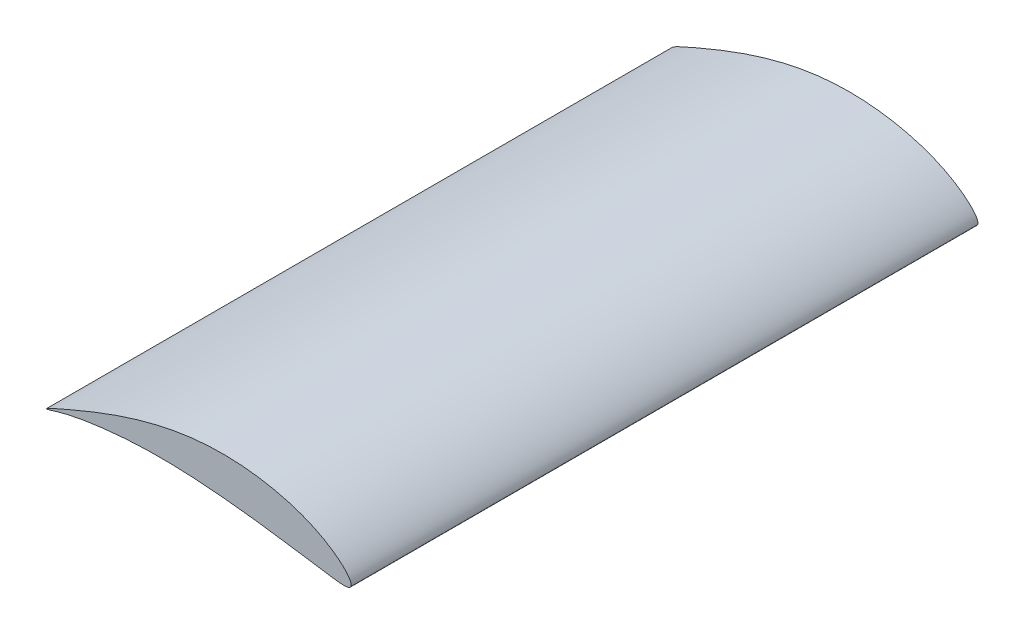
from build123d import *


with BuildPart() as part:
    # Sketch6 → Loft2 section 0
    with BuildSketch(Plane.XY.offset(575)):
        with BuildLine():
            Line((-280, 0.014), (-280, -0.0168))
            add(Edge.make_bspline(
                [(-280, 0.014), (-279.771204707, 0.168298563), (-278.925281642, 0.738785445), (-277.112099036, 1.81145493), (-274.256791715, 3.264911574), (-270.467152625, 4.947271328), (-265.823521768, 7.000905948), (-260.303724905, 9.42028278), (-253.91402689, 12.132526753), (-246.737129962, 15.134341951), (-238.843430318, 18.359152479), (-230.30810541, 21.720163504), (-221.209548369, 25.118644521), (-211.633086788, 28.475876512), (-201.657330859, 31.701051441), (-191.372693181, 34.739781453), (-180.858920985, 37.510498345), (-170.19634542, 39.945230809), (-159.46298851, 41.984143964), (-148.709485723, 43.578045859), (-137.965500671, 44.716042347), (-127.257988986, 45.368899266), (-116.627978631, 45.553296355), (-106.135165373, 45.2525479), (-95.831255312, 44.496915143), (-85.772634554, 43.300166367), (-76.015847778, 41.694402165), (-66.616324533, 39.711164622), (-57.631519759, 37.370622878), (-49.113009814, 34.710585168), (-41.121037488, 31.740670977), (-33.708616725, 28.508626142), (-26.931195064, 25.059138298), (-20.833732482, 21.471381025), (-15.446976943, 17.852019017), (-10.800507764, 14.285567161), (-6.927579355, 10.830684658), (-3.847816492, 7.562749849), (-1.603242544, 4.574322216), (-0.316842727, 2.089931642), (0.095551608, 0.147701002), (-0.190440036, -1.480082181), (-1.61812191, -2.811045927), (-3.984562706, -3.430210094), (-7.073967139, -3.624022711), (-10.943199102, -3.40377583), (-15.571371355, -2.867925005), (-20.94644222, -2.096282411), (-27.038024035, -1.181253274), (-33.809090153, -0.184623427), (-41.207726299, 0.925009114), (-49.187017114, 2.121630313), (-57.689757713, 3.391059344), (-66.663520395, 4.695267901), (-76.051592973, 6.00864435), (-85.798563098, 7.298385015), (-95.847404644, 8.537804845), (-106.140739912, 9.705668586), (-116.623055594, 10.774641585), (-127.242646453, 11.725374761), (-137.939971466, 12.533150396), (-148.676044421, 13.17282768), (-159.423043152, 13.618134398), (-170.153814535, 13.851060052), (-180.816971888, 13.85021665), (-191.33398763, 13.611065767), (-201.623483582, 13.125096615), (-211.601932998, 12.43090999), (-221.184797018, 11.549819182), (-230.291064503, 10.525338005), (-238.836766895, 9.364172827), (-246.740627761, 8.100177645), (-253.922603644, 6.76061863), (-260.310347725, 5.398675468), (-265.845478515, 4.059802982), (-270.478571586, 2.730749917), (-274.209001992, 1.523994274), (-277.055525725, 0.667762124), (-278.895533479, 0.202482489), (-279.77017857, 0.028829102), (-280, -0.0168)],
                knots=[0, 0, 0, 0, 0.001413477, 0.005226038, 0.010781091, 0.017815608, 0.026460951, 0.036790889, 0.048685593, 0.062017125, 0.076639155, 0.092362872, 0.109003461, 0.126386903, 0.144339126, 0.162701027, 0.181312719, 0.200023431, 0.218712626, 0.237261299, 0.255692478, 0.274037197, 0.292192583, 0.310132767, 0.327788163, 0.345096618, 0.362001934, 0.378421226, 0.394286639, 0.40954344, 0.424114253, 0.43793778, 0.450941833, 0.463044023, 0.474154417, 0.484164575, 0.493023962, 0.500713088, 0.507125739, 0.512129705, 0.514904185, 0.517171427, 0.520261618, 0.5242453, 0.529497961, 0.536092185, 0.54406114, 0.553363127, 0.563904543, 0.575614949, 0.588420092, 0.60222661, 0.616944448, 0.632456508, 0.648675826, 0.665501113, 0.682818193, 0.700538488, 0.718564132, 0.736789145, 0.755151415, 0.773513212, 0.791877576, 0.810244924, 0.828488569, 0.846493195, 0.864125178, 0.88124851, 0.897725282, 0.913415058, 0.928184346, 0.941897285, 0.954411455, 0.965602702, 0.975349728, 0.983575522, 0.990284579, 0.99543259, 0.998799869, 1, 1, 1, 1], degree=3))
        make_face()
    # Sketch3 → Loft2 section 1
    with BuildSketch(Plane(origin=(0, 0, 0), x_dir=(-1, 0, 0), z_dir=(0, 0, -1))):
        with BuildLine():
            Line((280, 0.014), (280, -0.0168))
            add(Edge.make_bspline(
                [(280, 0.014), (279.771204707, 0.168298563), (278.925281642, 0.738785445), (277.112099036, 1.81145493), (274.256791715, 3.264911574), (270.467152625, 4.947271328), (265.823521768, 7.000905948), (260.303724905, 9.42028278), (253.91402689, 12.132526753), (246.737129962, 15.134341951), (238.843430318, 18.359152479), (230.30810541, 21.720163504), (221.209548369, 25.118644521), (211.633086788, 28.475876512), (201.657330859, 31.701051441), (191.372693181, 34.739781453), (180.858920985, 37.510498345), (170.19634542, 39.945230809), (159.46298851, 41.984143964), (148.709485723, 43.578045859), (137.965500671, 44.716042347), (127.257988986, 45.368899266), (116.627978631, 45.553296355), (106.135165373, 45.2525479), (95.831255312, 44.496915143), (85.772634554, 43.300166367), (76.015847778, 41.694402165), (66.616324533, 39.711164622), (57.631519759, 37.370622878), (49.113009814, 34.710585168), (41.121037488, 31.740670977), (33.708616725, 28.508626142), (26.931195064, 25.059138298), (20.833732482, 21.471381025), (15.446976943, 17.852019017), (10.800507764, 14.285567161), (6.927579355, 10.830684658), (3.847816492, 7.562749849), (1.603242544, 4.574322216), (0.316842727, 2.089931642), (-0.095551608, 0.147701002), (0.190440036, -1.480082181), (1.61812191, -2.811045927), (3.984562706, -3.430210094), (7.073967139, -3.624022711), (10.943199102, -3.40377583), (15.571371355, -2.867925005), (20.94644222, -2.096282411), (27.038024035, -1.181253274), (33.809090153, -0.184623427), (41.207726299, 0.925009114), (49.187017114, 2.121630313), (57.689757713, 3.391059344), (66.663520395, 4.695267901), (76.051592973, 6.00864435), (85.798563098, 7.298385015), (95.847404644, 8.537804845), (106.140739912, 9.705668586), (116.623055594, 10.774641585), (127.242646453, 11.725374761), (137.939971466, 12.533150396), (148.676044421, 13.17282768), (159.423043152, 13.618134398), (170.153814535, 13.851060052), (180.816971888, 13.85021665), (191.33398763, 13.611065767), (201.623483582, 13.125096615), (211.601932998, 12.43090999), (221.184797018, 11.549819182), (230.291064503, 10.525338005), (238.836766895, 9.364172827), (246.740627761, 8.100177645), (253.922603644, 6.76061863), (260.310347725, 5.398675468), (265.845478515, 4.059802982), (270.478571586, 2.730749917), (274.209001992, 1.523994274), (277.055525725, 0.667762124), (278.895533479, 0.202482489), (279.77017857, 0.028829102), (280, -0.0168)],
                knots=[0, 0, 0, 0, 0.001413477, 0.005226038, 0.010781091, 0.017815608, 0.026460951, 0.036790889, 0.048685593, 0.062017125, 0.076639155, 0.092362872, 0.109003461, 0.126386903, 0.144339126, 0.162701027, 0.181312719, 0.200023431, 0.218712626, 0.237261299, 0.255692478, 0.274037197, 0.292192583, 0.310132767, 0.327788163, 0.345096618, 0.362001934, 0.378421226, 0.394286639, 0.40954344, 0.424114253, 0.43793778, 0.450941833, 0.463044023, 0.474154417, 0.484164575, 0.493023962, 0.500713088, 0.507125739, 0.512129705, 0.514904185, 0.517171427, 0.520261618, 0.5242453, 0.529497961, 0.536092185, 0.54406114, 0.553363127, 0.563904543, 0.575614949, 0.588420092, 0.60222661, 0.616944448, 0.632456508, 0.648675826, 0.665501113, 0.682818193, 0.700538488, 0.718564132, 0.736789145, 0.755151415, 0.773513212, 0.791877576, 0.810244924, 0.828488569, 0.846493195, 0.864125178, 0.88124851, 0.897725282, 0.913415058, 0.928184346, 0.941897285, 0.954411455, 0.965602702, 0.975349728, 0.983575522, 0.990284579, 0.99543259, 0.998799869, 1, 1, 1, 1], degree=3))
        make_face()
    loft()


solid = part.part
